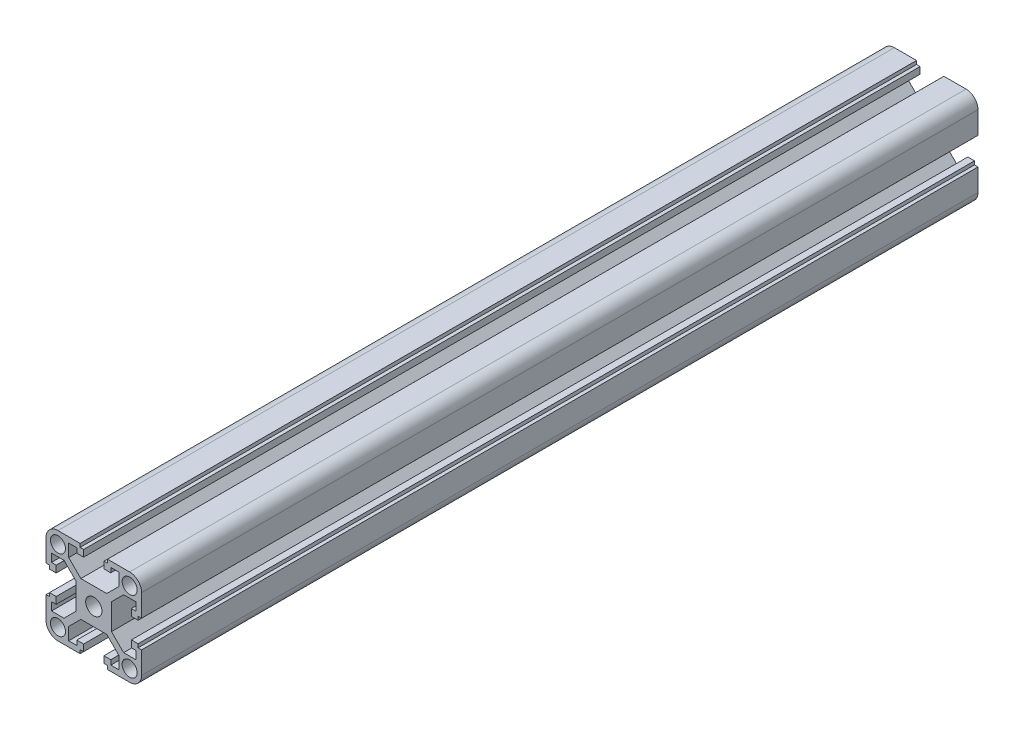
from build123d import *

# Parameters (mm, degrees)
SKETCH_1_R      = 3.4
SKETCH_1_R_2    = 3.15
EXTRUDE_1_DEPTH = 175


with BuildPart() as part:
    # Эскиз1 → Бобышка-Вытянуть1 (new, symmetric)
    with BuildSketch(Plane.XY):
        with BuildLine():
            Line((-15, 20), (-5.727351849, 20))
            Line((-5.727351849, 20), (-5.727351849, 18.530416438))
            Line((-5.727351849, 18.530416438), (-4.25, 18.530416438))
            Line((-4.25, 18.530416438), (-4.25, 15.732027397))
            Line((-4.25, 15.732027397), (-7.111831817, 15.732027397))
            Line((-7.111831817, 15.732027397), (-7.111831817, 17.7))
            Line((-7.111831817, 17.7), (-10.5, 17.7))
            Line((-10.5, 17.7), (-10.5, 12.479898987))
            Line((-10.5, 12.479898987), (-5.420101013, 7.4))
            Line((-5.420101013, 7.4), (5.420101013, 7.4))
            Line((5.420101013, 7.4), (10.5, 12.479898987))
            Line((10.5, 12.479898987), (10.5, 17.7))
            Line((10.5, 17.7), (7.111831817, 17.7))
            Line((7.111831817, 17.7), (7.111831817, 15.732027397))
            Line((7.111831817, 15.732027397), (4.25, 15.732027397))
            Line((4.25, 15.732027397), (4.25, 18.530416438))
            Line((4.25, 18.530416438), (5.727351849, 18.530416438))
            Line((5.727351849, 18.530416438), (5.727351849, 20))
            Line((5.727351849, 20), (15, 20))
            ThreePointArc((15, 20), (18.535533906, 18.535533906), (20, 15))
            Line((20, 15), (20, 5.727351849))
            Line((20, 5.727351849), (18.530416438, 5.727351849))
            Line((18.530416438, 5.727351849), (18.530416438, 4.25))
            Line((18.530416438, 4.25), (15.732027397, 4.25))
            Line((15.732027397, 4.25), (15.732027397, 7.111831817))
            Line((15.732027397, 7.111831817), (17.7, 7.111831817))
            Line((17.7, 7.111831817), (17.7, 10.5))
            Line((17.7, 10.5), (12.479898987, 10.5))
            Line((12.479898987, 10.5), (7.4, 5.420101013))
            Line((7.4, 5.420101013), (7.4, -5.420101013))
            Line((7.4, -5.420101013), (12.479898987, -10.5))
            Line((12.479898987, -10.5), (17.7, -10.5))
            Line((17.7, -10.5), (17.7, -7.111831817))
            Line((17.7, -7.111831817), (15.732027397, -7.111831817))
            Line((15.732027397, -7.111831817), (15.732027397, -4.25))
            Line((15.732027397, -4.25), (18.530416438, -4.25))
            Line((18.530416438, -4.25), (18.530416438, -5.727351849))
            Line((18.530416438, -5.727351849), (20, -5.727351849))
            Line((20, -5.727351849), (20, -15))
            ThreePointArc((20, -15), (18.535533906, -18.535533906), (15, -20))
            Line((15, -20), (5.727351849, -20))
            Line((5.727351849, -20), (5.727351849, -18.530416438))
            Line((5.727351849, -18.530416438), (4.25, -18.530416438))
            Line((4.25, -18.530416438), (4.25, -15.732027397))
            Line((4.25, -15.732027397), (7.111831817, -15.732027397))
            Line((7.111831817, -15.732027397), (7.111831817, -17.7))
            Line((7.111831817, -17.7), (10.5, -17.7))
            Line((10.5, -17.7), (10.5, -12.479898987))
            Line((10.5, -12.479898987), (5.420101013, -7.4))
            Line((5.420101013, -7.4), (-5.420101013, -7.4))
            Line((-5.420101013, -7.4), (-10.5, -12.479898987))
            Line((-10.5, -12.479898987), (-10.5, -17.7))
            Line((-10.5, -17.7), (-7.111831817, -17.7))
            Line((-7.111831817, -17.7), (-7.111831817, -15.732027397))
            Line((-7.111831817, -15.732027397), (-4.25, -15.732027397))
            Line((-4.25, -15.732027397), (-4.25, -18.530416438))
            Line((-4.25, -18.530416438), (-5.727351849, -18.530416438))
            Line((-5.727351849, -18.530416438), (-5.727351849, -20))
            Line((-5.727351849, -20), (-15, -20))
            ThreePointArc((-15, -20), (-18.535533906, -18.535533906), (-20, -15))
            Line((-20, -15), (-20, -5.727351849))
            Line((-20, -5.727351849), (-18.530416438, -5.727351849))
            Line((-18.530416438, -5.727351849), (-18.530416438, -4.25))
            Line((-18.530416438, -4.25), (-15.732027397, -4.25))
            Line((-15.732027397, -4.25), (-15.732027397, -7.111831817))
            Line((-15.732027397, -7.111831817), (-17.7, -7.111831817))
            Line((-17.7, -7.111831817), (-17.7, -10.5))
            Line((-17.7, -10.5), (-12.479898987, -10.5))
            Line((-12.479898987, -10.5), (-7.4, -5.420101013))
            Line((-7.4, -5.420101013), (-7.4, 5.420101013))
            Line((-7.4, 5.420101013), (-12.479898987, 10.5))
            Line((-12.479898987, 10.5), (-17.7, 10.5))
            Line((-17.7, 10.5), (-17.7, 7.111831817))
            Line((-17.7, 7.111831817), (-15.732027397, 7.111831817))
            Line((-15.732027397, 7.111831817), (-15.732027397, 4.25))
            Line((-15.732027397, 4.25), (-18.530416438, 4.25))
            Line((-18.530416438, 4.25), (-18.530416438, 5.727351849))
            Line((-18.530416438, 5.727351849), (-20, 5.727351849))
            Line((-20, 5.727351849), (-20, 15))
            ThreePointArc((-20, 15), (-18.535533906, 18.535533906), (-15, 20))
        make_face()
        Circle(SKETCH_1_R, mode=Mode.SUBTRACT)
        with Locations((-15, 15)):
            Circle(SKETCH_1_R_2, mode=Mode.SUBTRACT)
        with Locations((15, 15)):
            Circle(SKETCH_1_R_2, mode=Mode.SUBTRACT)
        with Locations((15, -15)):
            Circle(SKETCH_1_R_2, mode=Mode.SUBTRACT)
        with Locations((-15, -15)):
            Circle(SKETCH_1_R_2, mode=Mode.SUBTRACT)
    extrude(amount=EXTRUDE_1_DEPTH, both=True)


solid = part.part
